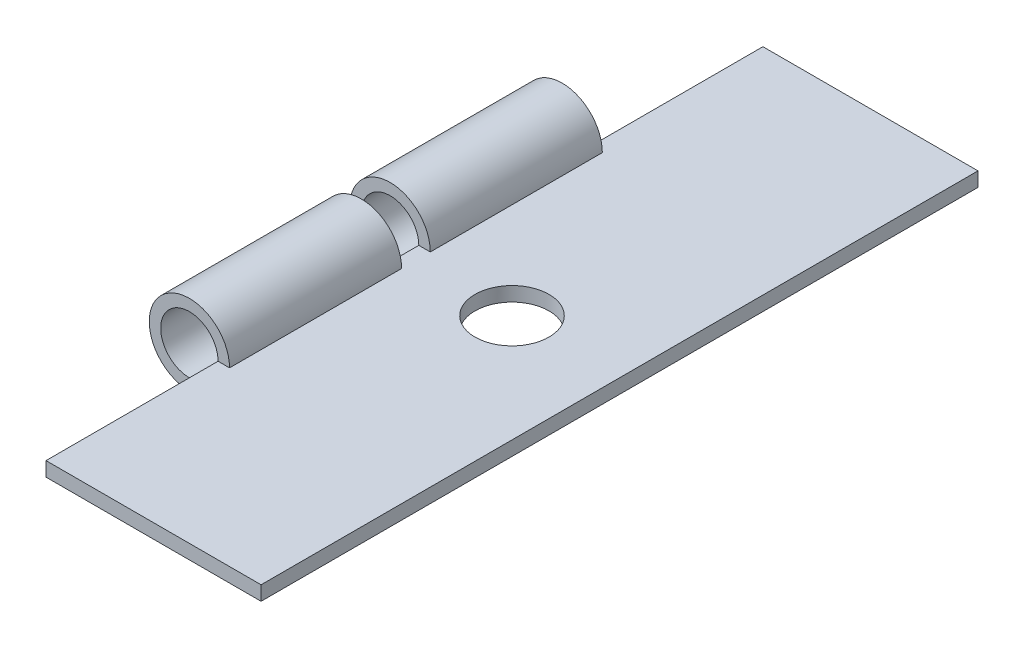
from build123d import *

# Parameters (mm, degrees)
SKETCH1_W           = 9.525
SKETCH1_H           = 31.75
BOSS_EXTRUDE1_DEPTH = 0.3175
SKETCH5_W           = 0.508
SKETCH5_H           = 7.62
SKETCH6_R           = 1.6383
CUT_EXTRUDE1_DEPTH  = 12.7


with BuildPart() as part:
    # Sketch1 → Boss-Extrude1 (new, symmetric)
    with BuildSketch(Plane(origin=(0, 0, 0), x_dir=(1, 0, 0), z_dir=(0, 1, 0))):
        Rectangle(SKETCH1_W, SKETCH1_H)
    extrude(amount=BOSS_EXTRUDE1_DEPTH, both=True)

    # Sketch5 → Revolve3 (revolve)
    with BuildSketch(Plane(origin=(0, 0.3175, 0), x_dir=(1, 0, 0), z_dir=(0, 1, 0))):
        with Locations((-4.5085, 4.445)):
            Rectangle(SKETCH5_W, SKETCH5_H)
    revolve3 = revolve(axis=Axis((-6.0325, 0.3175, -15.875), (0, 0, 1)))

    # Mirror2: Revolve3 across plane
    add(revolve3.mirror(Plane.XY))

    # Sketch6 → Cut-Extrude1 (cut)
    with BuildSketch(Plane(origin=(0, 0.3175, 0), x_dir=(1, 0, 0), z_dir=(0, 1, 0))):
        with Locations(Location((0, 0, 0), (0, 0, 270))):
            Circle(SKETCH6_R)
    extrude(amount=-CUT_EXTRUDE1_DEPTH, mode=Mode.SUBTRACT)


solid = part.part
